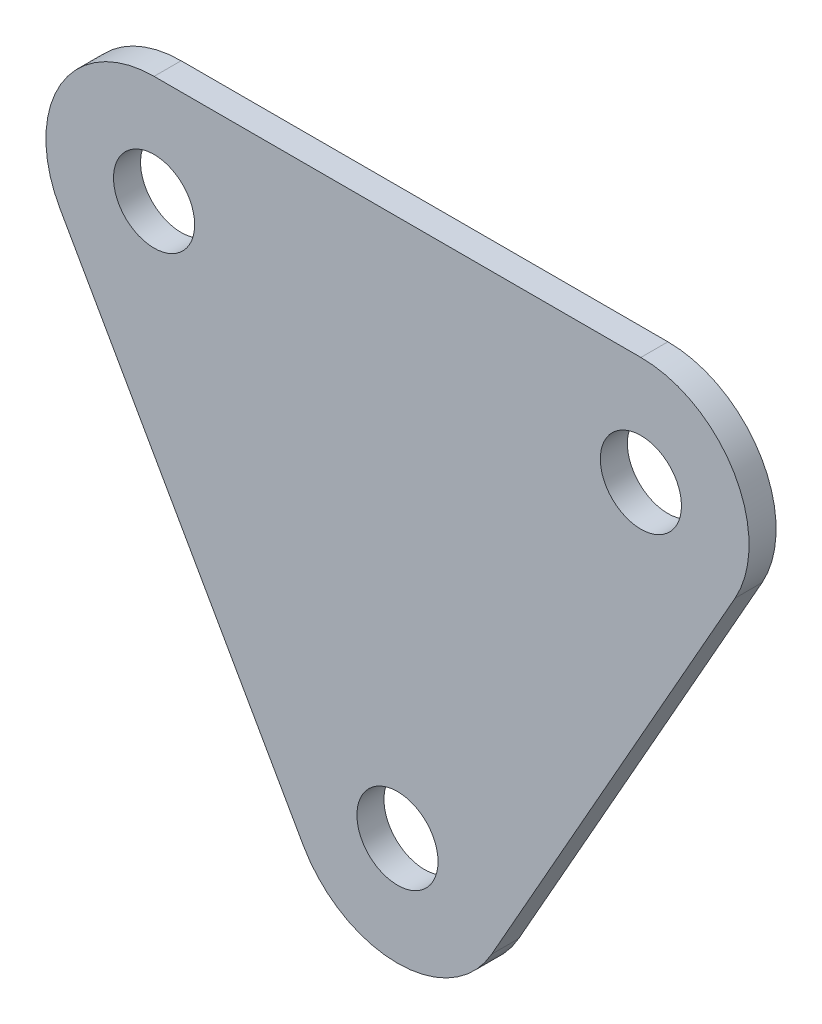
from build123d import *

# Parameters (mm, degrees)
SKETCH2_R           = 30
BOSS_EXTRUDE1_DEPTH = 20


with BuildPart() as part:
    # Sketch2 → Boss-Extrude1 (new body)
    with BuildSketch(Plane.XY):
        with BuildLine():
            Line((110.379451594, -357.407857588), (-69.620548406, -39.407857588))
            ThreePointArc((-69.620548406, -39.407857588), (-69.110884118, 40.294983515), (0, 80))
            Line((0, 80), (360, 80))
            ThreePointArc((360, 80), (429.110884118, 40.294983515), (429.620548406, -39.407857588))
            Line((429.620548406, -39.407857588), (249.620548406, -357.407857588))
            ThreePointArc((249.620548406, -357.407857588), (180, -398), (110.379451594, -357.407857588))
        make_face()
        Circle(SKETCH2_R, mode=Mode.SUBTRACT)
        with Locations((360, 0)):
            Circle(SKETCH2_R, mode=Mode.SUBTRACT)
        with Locations((180, -318)):
            Circle(SKETCH2_R, mode=Mode.SUBTRACT)
    extrude(amount=BOSS_EXTRUDE1_DEPTH)


solid = part.part
